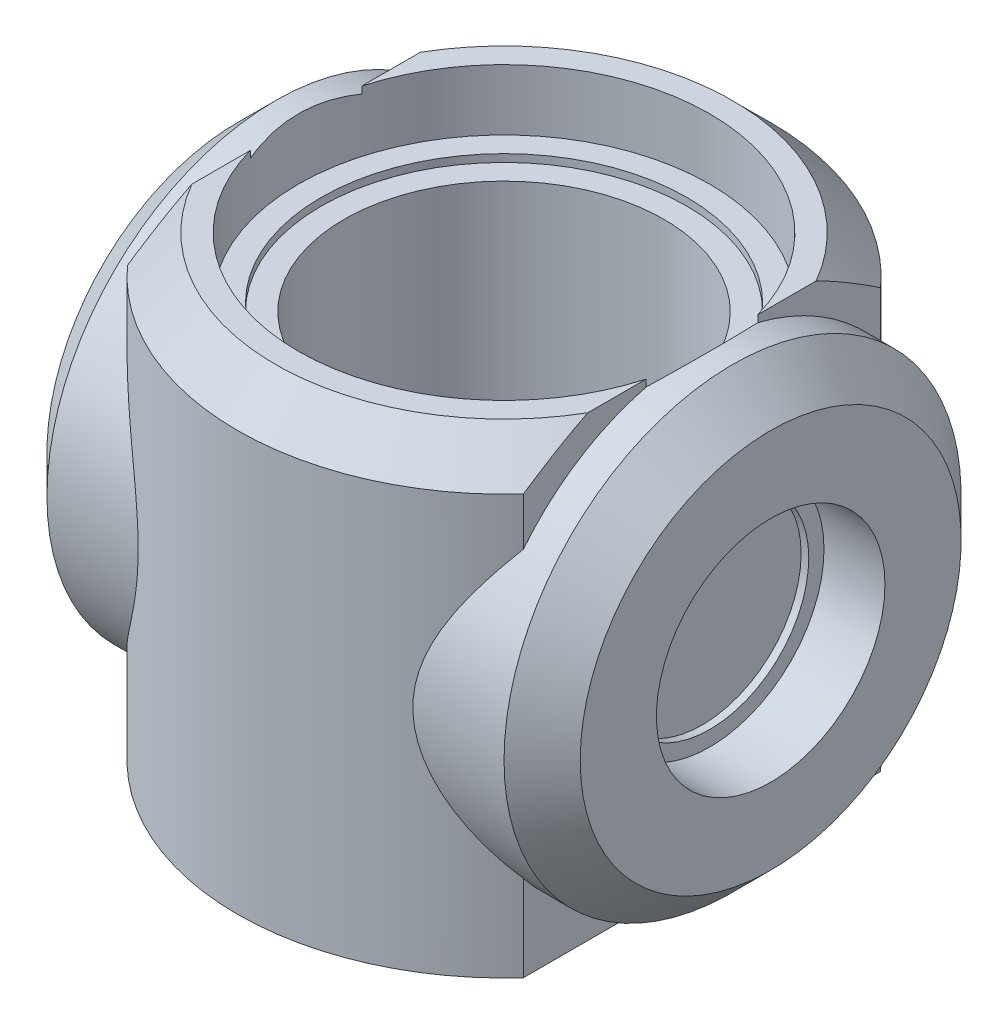
from build123d import *

# Parameters (mm, degrees)
BOSS_EXTRUDE1_DEPTH  = 15
F_2_5MM_CHAMFER_SIZE = 2.5


with BuildPart() as part:
    # Sketch3 → Revolve1 (revolve)
    with BuildSketch(Plane(origin=(0, 0, 0), x_dir=(1, 0, 0), z_dir=(0, 1, 0))):
        Polygon((0, 0), (-13, 0), (-13, 6.5), (-13.5, 6.5), (-13.5, 7.5), (-17.5, 7.5), (-17.5, 15), (0, 15), align=None)
    revolve1 = revolve(axis=Axis((0, 0, 0), (-1, 0, 0)))

    # Mirror1: Revolve1 across plane
    add(revolve1.mirror(Plane(origin=(0, 0, 0), x_dir=(0, 0, 1), z_dir=(1, 0, 0))))

    # Sketch6 → Boss-Extrude1 (add, symmetric)
    with BuildSketch(Plane(origin=(0, 0, 0), x_dir=(1, 0, 0), z_dir=(0, 1, 0))):
        with BuildLine():
            ThreePointArc((12.993588105, 11.722485579), (0, 17.5), (-12.993588105, 11.722485579))
            Line((-12.993588105, 11.722485579), (-12.993588105, -11.722485579))
            ThreePointArc((-12.993588105, -11.722485579), (0, -17.5), (12.993588105, -11.722485579))
            Line((12.993588105, -11.722485579), (12.993588105, 11.722485579))
        make_face()
    extrude(amount=BOSS_EXTRUDE1_DEPTH, both=True)

    # Sketch8 → Cut-Revolve1 (revolve, cut)
    with BuildSketch(Plane.XY, mode=Mode.PRIVATE) as cut_revolve1_sk:
        Polygon((0, -15), (13.5, -15), (13.5, -11), (12, -11), (12, -10.5), (10.5, -10.5), (10.5, 10.5), (12, 10.5), (12, 11), (13.5, 11), (13.5, 15), (0, 15), align=None)
    revolve(cut_revolve1_sk.sketch.rotate(Axis((0, 15, 0), (0, -1, 0)), 90), axis=Axis((0, 15, 0), (0, -1, 0)), mode=Mode.SUBTRACT)

    # 2,5mm Chamfer
    f_2_5mm_chamfer_edges = [part.edges().sort_by_distance(p)[0] for p in [
        (-17.5, 0, 15),
        (17.5, 0, 15),
        (0, 15, 17.5),
        (0, 15, -17.5),
    ]]
    chamfer(f_2_5mm_chamfer_edges, length=F_2_5MM_CHAMFER_SIZE)


solid = part.part
